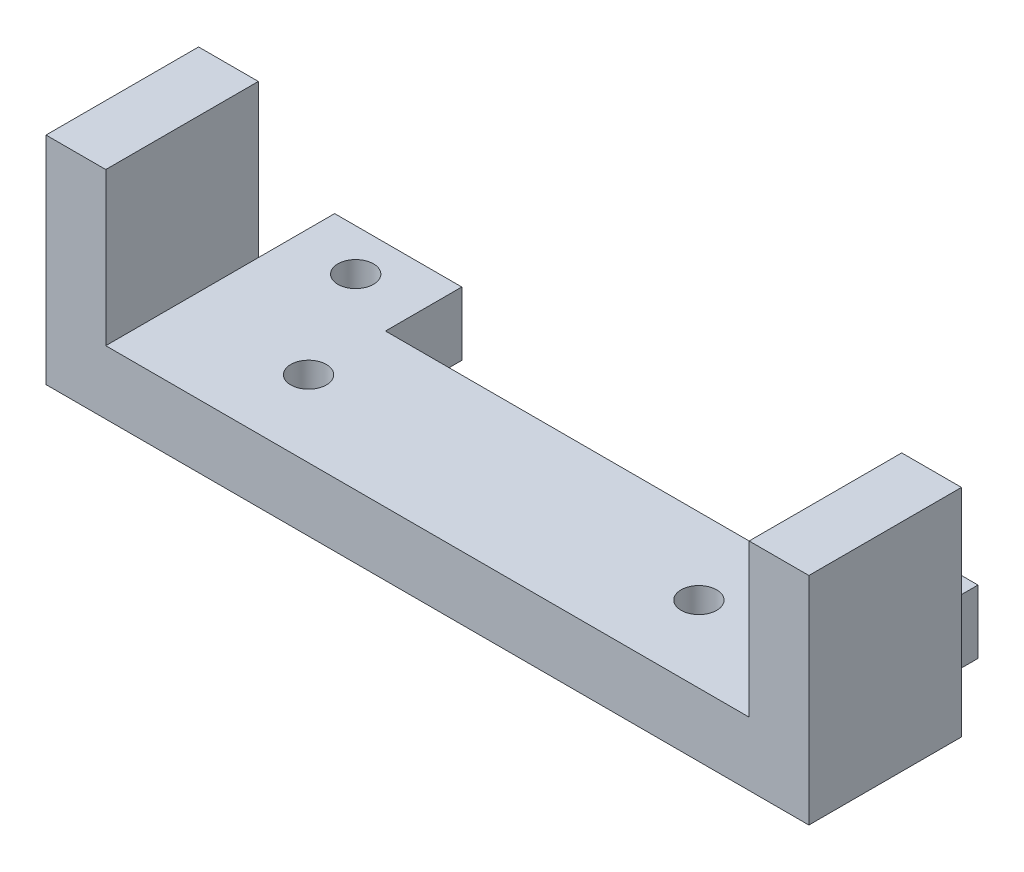
from build123d import *

# Parameters (mm, degrees)
SKETCH_1_W      = 60
SKETCH_1_H      = 12
EXTRUDE_1_DEPTH = 5
SKETCH_2_W      = 4.7
SKETCH_2_H      = 12
EXTRUDE_2_DEPTH = 12
M3X0_5_3_D      = 2.8
SKETCH_12_W     = 10
SKETCH_12_H     = 6
EXTRUDE_3_DEPTH = 5
M3X0_5_4_D      = 2.8


with BuildPart() as part:
    # 草图1 → 凸台-拉伸1 (new body)
    with BuildSketch(Plane(origin=(0, 0, 0), x_dir=(1, 0, 0), z_dir=(0, 1, 0))):
        Rectangle(SKETCH_1_W, SKETCH_1_H)
    extrude(amount=EXTRUDE_1_DEPTH)

    # 草图2 → 凸台-拉伸2 (add)
    with BuildSketch(Plane(origin=(0, 5, 0), x_dir=(1, 0, 0), z_dir=(0, 1, 0))):
        with Locations((-27.65, 0)):
            Rectangle(SKETCH_2_W, SKETCH_2_H)
        with Locations((27.65, 0)):
            Rectangle(SKETCH_2_W, SKETCH_2_H)
    extrude(amount=EXTRUDE_2_DEPTH)

    # M3x0.5 螺纹孔3 (through all)
    with Locations(Plane(origin=(0, 0, 0), x_dir=(-1, 0, 0), z_dir=(0, -1, 0))):
        with Locations((-15.35, 0), (15.35, 0)):
            Hole(M3X0_5_3_D / 2)

    # 草图12 → 凸台-拉伸3 (add)
    with BuildSketch(Plane(origin=(0, 5, 0), x_dir=(1, 0, 0), z_dir=(0, 1, 0))):
        with Locations((-20.3, 9)):
            Rectangle(SKETCH_12_W, SKETCH_12_H)
        with Locations((20.3, 9)):
            Rectangle(SKETCH_12_W, SKETCH_12_H)
    extrude(amount=-EXTRUDE_3_DEPTH)

    # M3x0.5 螺纹孔4 (through all)
    with Locations(Plane(origin=(0, 0, 0), x_dir=(-1, 0, 0), z_dir=(0, -1, 0))):
        with Locations((20.35, 8.706622657), (-20.35, 8.706622657)):
            Hole(M3X0_5_4_D / 2)


solid = part.part
